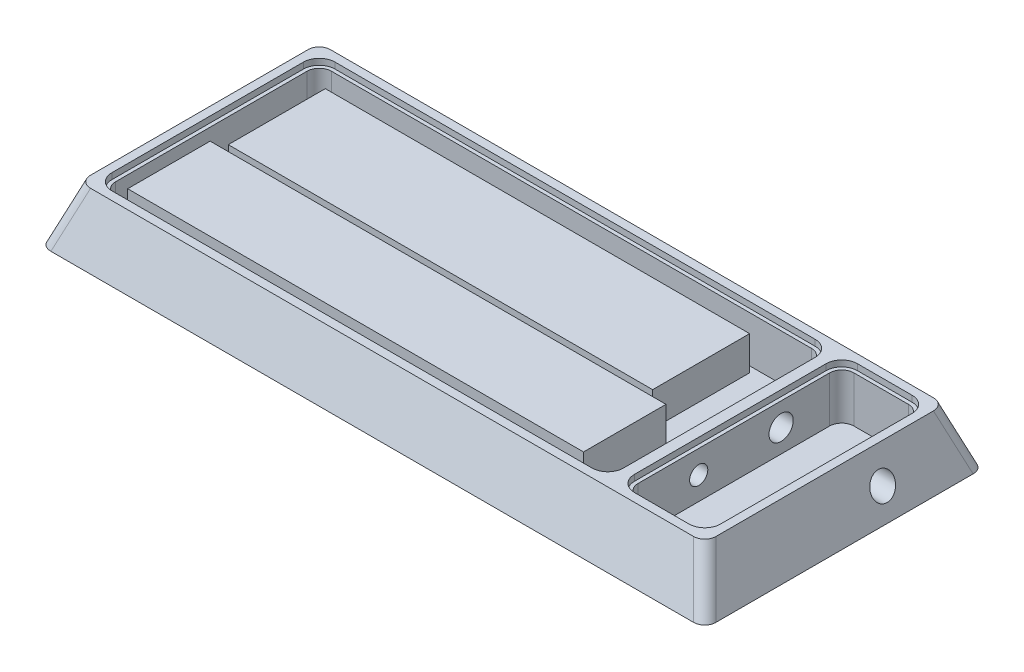
from build123d import *

# Parameters (mm, degrees)
SKETCH2_W                      = 516
SKETCH2_H                      = 198
SKETCH2_W_2                    = 65
SKETCH2_H_2                    = 178
SKETCH2_W_3                    = 416
BOSS_EXTRUDE2_DEPTH            = 45
DRAFT3_ANGLE                   = 20
FILLET1_R                      = 10
SKETCH2_3_W                    = 416
SKETCH2_3_H                    = 178
SKETCH2_3_W_2                  = 350
SKETCH2_3_H_2                  = 80
SKETCH2_3_W_3                  = 376
SKETCH2_3_H_3                  = 68
SKETCH2_3_W_4                  = 65
BOSS_EXTRUDE3_DEPTH            = 2
CUT_EXTRUDE1_DEPTH             = 5
SKETCH2_5_W                    = 376
SKETCH2_5_H                    = 68
BOSS_EXTRUDE4_DEPTH            = 40
SKETCH2_6_W                    = 350
SKETCH2_6_H                    = 80
BOSS_EXTRUDE5_DEPTH            = 30
CUT_EXTRUDE2_REACH             = 538.858
SKETCH4_R                      = 10
CUT_EXTRUDE2_DIRECTION_2_DEPTH = 54
SKETCH5_R                      = 7.5
CUT_EXTRUDE3_DEPTH             = 15


with BuildPart() as part:
    # Sketch2 → Boss-Extrude2 (new body)
    with BuildSketch(Plane(origin=(0, 0, 0), x_dir=(1, 0, 0), z_dir=(0, 1, 0))):
        Rectangle(SKETCH2_W, SKETCH2_H)
        with Locations((215.5, 0)):
            Rectangle(SKETCH2_W_2, SKETCH2_H_2, mode=Mode.SUBTRACT)
        with Locations((-40, 0)):
            Rectangle(SKETCH2_W_3, SKETCH2_H_2, mode=Mode.SUBTRACT)
    extrude(amount=BOSS_EXTRUDE2_DEPTH)

    # Draft3
    draft3_faces = [part.faces().sort_by_distance(p)[0] for p in [
        (0, 22.5, -99),
        (258, 22.5, 0),
        (0, 22.5, 99),
        (-258, 22.5, 0),
    ]]
    draft(draft3_faces, Plane.ZX.offset(45), DRAFT3_ANGLE)

    # Fillet1
    fillet1_edges = [part.edges().sort_by_distance(p)[0] for p in [
        (-248, 22.5, 89),
        (168, 22.5, 89),
        (168, 22.5, -89),
        (-248, 22.5, -89),
        (-266.189330271, 22.5, -107.189330271),
        (266.189330271, 22.5, -107.189330271),
        (266.189330271, 22.5, 107.189330271),
        (-266.189330271, 22.5, 107.189330271),
        (248, 22.5, 89),
        (248, 22.5, -89),
        (183, 22.5, -89),
        (183, 22.5, 89),
    ]]
    fillet(fillet1_edges, radius=FILLET1_R)

    # Sketch2<3> → Boss-Extrude3 (add)
    # profile 1 of 4: a face of its own
    with BuildSketch(Plane(origin=(0, 0, 0), x_dir=(1, 0, 0), z_dir=(0, 1, 0))):
        with Locations((-40, 0)):
            Rectangle(SKETCH2_3_W, SKETCH2_3_H)
        with Locations((-63, 44)):
            Rectangle(SKETCH2_3_W_2, SKETCH2_3_H_2, mode=Mode.SUBTRACT)
        with Locations((-50, -45)):
            Rectangle(SKETCH2_3_W_3, SKETCH2_3_H_3, mode=Mode.SUBTRACT)
    # profile 2 of 4: a face of its own
    with BuildSketch(Plane(origin=(0, 0, 0), x_dir=(1, 0, 0), z_dir=(0, 1, 0))):
        with Locations((-50, -45)):
            Rectangle(SKETCH2_3_W_3, SKETCH2_3_H_3)
    # profile 3 of 4: a face of its own
    with BuildSketch(Plane(origin=(0, 0, 0), x_dir=(1, 0, 0), z_dir=(0, 1, 0))):
        with Locations((-63, 44)):
            Rectangle(SKETCH2_3_W_2, SKETCH2_3_H_2)
    # profile 4 of 4: a face of its own
    with BuildSketch(Plane(origin=(0, 0, 0), x_dir=(1, 0, 0), z_dir=(0, 1, 0))):
        with Locations((215.5, 0)):
            Rectangle(SKETCH2_3_W_4, SKETCH2_3_H)
    extrude(amount=BOSS_EXTRUDE3_DEPTH)

    # Sketch3 → Cut-Extrude1 (cut)
    with BuildSketch(Plane(origin=(0, 45, 0), x_dir=(1, 0, 0), z_dir=(0, 1, 0))):
        with BuildLine():
            Line((171, -79), (171, 79))
            ThreePointArc((171, 79), (167.192388155, 88.192388155), (158, 92))
            Line((158, 92), (-238, 92))
            ThreePointArc((-238, 92), (-247.192388155, 88.192388155), (-251, 79))
            Line((-251, 79), (-251, -79))
            ThreePointArc((-251, -79), (-247.192388155, -88.192388155), (-238, -92))
            Line((-238, -92), (158, -92))
            ThreePointArc((158, -92), (167.192388155, -88.192388155), (171, -79))
        make_face()
        with BuildLine():
            Line((193, -92), (238, -92))
            ThreePointArc((238, -92), (247.192388155, -88.192388155), (251, -79))
            Line((251, -79), (251, 79))
            ThreePointArc((251, 79), (247.192388155, 88.192388155), (238, 92))
            Line((238, 92), (193, 92))
            ThreePointArc((193, 92), (183.807611845, 88.192388155), (180, 79))
            Line((180, 79), (180, -79))
            ThreePointArc((180, -79), (183.807611845, -88.192388155), (193, -92))
        make_face()
    extrude(amount=-CUT_EXTRUDE1_DEPTH, mode=Mode.SUBTRACT)

    # Sketch2<5> → Boss-Extrude4 (add)
    with BuildSketch(Plane(origin=(0, 0, 0), x_dir=(1, 0, 0), z_dir=(0, 1, 0))):
        with Locations((-50, -45)):
            Rectangle(SKETCH2_5_W, SKETCH2_5_H)
    extrude(amount=BOSS_EXTRUDE4_DEPTH)

    # Sketch2<6> → Boss-Extrude5 (add)
    with BuildSketch(Plane(origin=(0, 0, 0), x_dir=(1, 0, 0), z_dir=(0, 1, 0))):
        with Locations((-63, 44)):
            Rectangle(SKETCH2_6_W, SKETCH2_6_H)
    extrude(amount=BOSS_EXTRUDE5_DEPTH)

    # Cut-Extrude2: up to this face of the body (flat: up to its plane)
    cut_extrude2_end = Plane(part.part.faces().sort_by_distance((168, 21, 0))[0])
    # Sketch4 → Cut-Extrude2 (cut, up to the picked face)
    with BuildSketch(Plane.ZY.offset(-248), mode=Mode.PRIVATE) as cut_extrude2_sk1:
        with Locations((-39, 21)):
            Circle(SKETCH4_R)
    cut_extrude2_tool1 = split(extrude(cut_extrude2_sk1.sketch, amount=CUT_EXTRUDE2_REACH, mode=Mode.PRIVATE), bisect_by=cut_extrude2_end, keep=Keep.BOTH, mode=Mode.PRIVATE)
    add(cut_extrude2_tool1.solids().sort_by(Axis((248, 21, -39), (-1, 0, 0)))[0], mode=Mode.SUBTRACT)

    # Sketch4 → Cut-Extrude2 direction 2 (cut)
    with BuildSketch(Plane.ZY.offset(-248)):
        with Locations((-39, 21)):
            Circle(SKETCH4_R)
    extrude(amount=-CUT_EXTRUDE2_DIRECTION_2_DEPTH, mode=Mode.SUBTRACT)

    # Sketch5 → Cut-Extrude3 (cut)
    with BuildSketch(Plane(origin=(183, 0, 0), x_dir=(0, 0, -1), z_dir=(1, 0, 0))):
        with Locations((-29, 21)):
            Circle(SKETCH5_R)
    extrude(amount=-CUT_EXTRUDE3_DEPTH, mode=Mode.SUBTRACT)


solid = part.part
